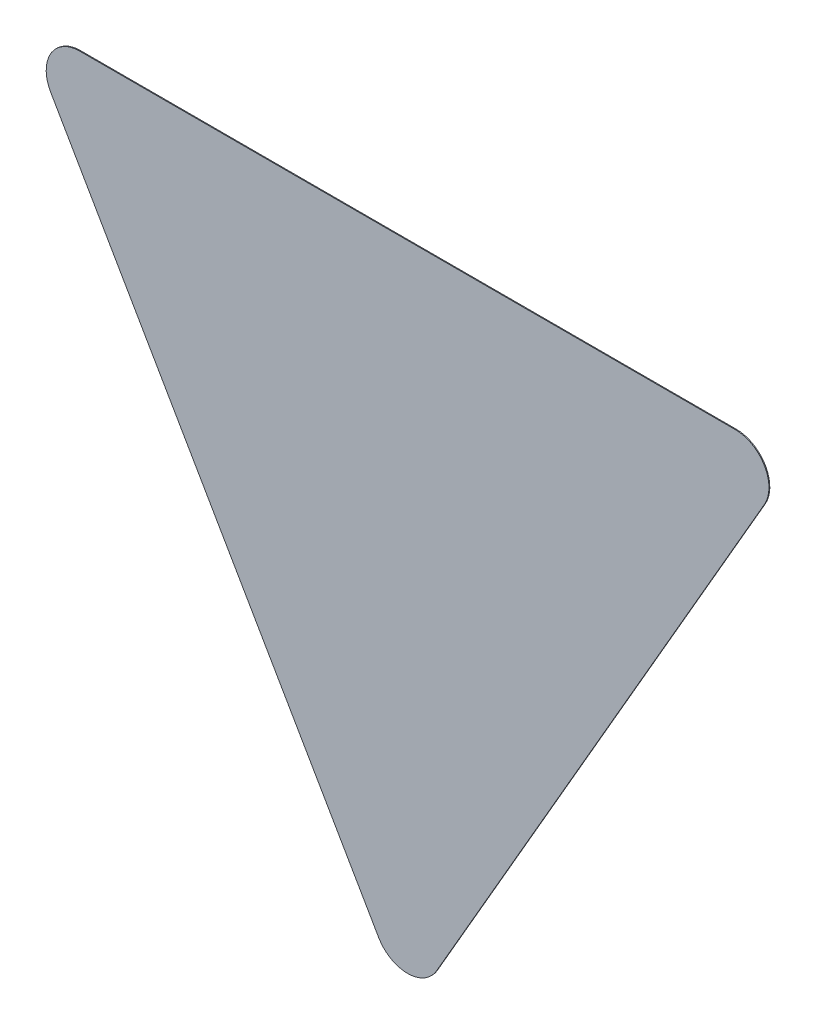
from build123d import *

# Parameters (mm, degrees)
BOSS_EXTRUDE1_DEPTH = 0.065


with BuildPart() as part:
    # Sketch1 → Boss-Extrude1 (new body)
    with BuildSketch(Plane.XY):
        with BuildLine():
            Line((0, 25), (-24.537373991, 25))
            ThreePointArc((-24.537373991, 25), (-26.702437374, 23.750000219), (-26.702437752, 21.250000437))
            Line((-26.702437752, 21.250000437), (-2.165063762, -21.249997814))
            ThreePointArc((-2.165063762, -21.249997814), (0, -22.499998252), (2.165063762, -21.249997814))
            Line((2.165063762, -21.249997814), (26.702437752, 21.250000437))
            ThreePointArc((26.702437752, 21.250000437), (26.702437374, 23.750000219), (24.537373991, 25))
            Line((24.537373991, 25), (0, 25))
        make_face()
    extrude(amount=BOSS_EXTRUDE1_DEPTH)


solid = part.part
